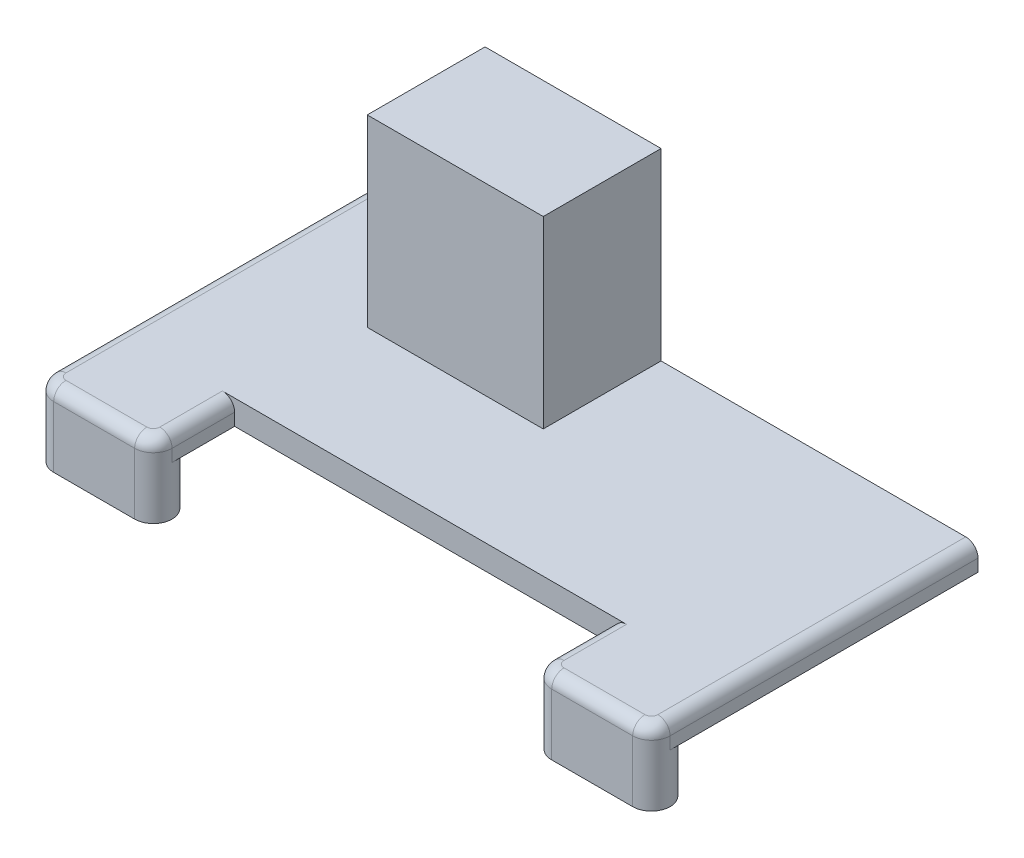
from build123d import *

# Parameters (mm, degrees)
BOSS_EXTRUDE1_DEPTH   = 4
BOSS_EXTRUDE1_2_DEPTH = 4
BOSS_EXTRUDE3_DEPTH   = 2
FILLET2_R             = 1
SKETCH4_W             = 14.347682942
SKETCH4_H             = 9.604544397
BOSS_EXTRUDE4_DEPTH   = 15


with BuildPart() as part:
    # Sketch1 → Boss-Extrude1 (new body)
    with BuildSketch(Plane(origin=(0, 0, 0), x_dir=(1, 0, 0), z_dir=(0, 1, 0))):
        with BuildLine():
            Line((-23.6, 10.542278437), (-17, 10.542278437))
            ThreePointArc((-17, 10.542278437), (-15.475, 9.017278437), (-17, 7.492278437))
            Line((-17, 7.492278437), (-23.6, 7.492278437))
            ThreePointArc((-23.6, 7.492278437), (-25.125, 9.017278437), (-23.6, 10.542278437))
        make_face()
    extrude(amount=BOSS_EXTRUDE1_DEPTH)



with BuildPart() as body_2:
    # Sketch1 → Boss-Extrude1 2 (new body)
    with BuildSketch(Plane(origin=(0, 0, 0), x_dir=(1, 0, 0), z_dir=(0, 1, 0))):
        with BuildLine():
            Line((23.6, 7.492278437), (17, 7.492278437))
            ThreePointArc((17, 7.492278437), (15.475, 9.017278437), (17, 10.542278437))
            Line((17, 10.542278437), (23.6, 10.542278437))
            ThreePointArc((23.6, 10.542278437), (25.125, 9.017278437), (23.6, 7.492278437))
        make_face()
    extrude(amount=BOSS_EXTRUDE1_2_DEPTH)


with BuildPart() as part_1:
    add(part.part)

    add(body_2.part)  # Boss-Extrude3 merges body 2
    # Sketch3 → Boss-Extrude3 (add)
    with BuildSketch(Plane(origin=(0, 4, 0), x_dir=(1, 0, 0), z_dir=(0, 1, 0))):
        with BuildLine():
            ThreePointArc((15.475, 9.017278437), (15.921662159, 7.938940596), (17, 7.492278437))
            Line((17, 7.492278437), (23.6, 7.492278437))
            ThreePointArc((23.6, 7.492278437), (24.678337841, 7.938940596), (25.125, 9.017278437))
            Line((25.125, 9.017278437), (25.125, 17.305889592))
            Line((25.125, 17.305889592), (25.125, 34.117278437))
            Line((25.125, 34.117278437), (-25.125, 34.117278437))
            Line((-25.125, 34.117278437), (-25.125, 17.305889592))
            Line((-25.125, 17.305889592), (-25.125, 9.017278437))
            ThreePointArc((-25.125, 9.017278437), (-24.678337841, 10.095616278), (-23.6, 10.542278437))
            Line((-23.6, 10.542278437), (-17, 10.542278437))
            ThreePointArc((-17, 10.542278437), (-15.921662159, 10.095616278), (-15.475, 9.017278437))
            Line((-15.475, 9.017278437), (-15.475, 14.117278437))
            Line((-15.475, 14.117278437), (15.475, 14.117278437))
            Line((15.475, 14.117278437), (15.475, 9.017278437))
        make_face()
        with BuildLine():
            Line((-17, 10.542278437), (-23.6, 10.542278437))
            ThreePointArc((-23.6, 10.542278437), (-25.125, 9.017278437), (-23.6, 7.492278437))
            Line((-23.6, 7.492278437), (-17, 7.492278437))
            ThreePointArc((-17, 7.492278437), (-15.475, 9.017278437), (-17, 10.542278437))
        make_face()
    extrude(amount=BOSS_EXTRUDE3_DEPTH)

    # Fillet2
    fillet2_edges = [part_1.edges().sort_by_distance(p)[0] for p in [
        (-25.125, 6, -21.567278437),
        (15.475, 6, -11.567278437),
        (-24.678337841, 6, -7.938940596),
        (-20.3, 6, -7.492278437),
        (-15.921662159, 6, -7.938940596),
        (-15.475, 6, -11.567278437),
        (15.921662159, 6, -7.938940596),
        (20.3, 6, -7.492278437),
        (24.678337841, 6, -7.938940596),
        (25.125, 6, -21.567278437),
    ]]
    fillet(fillet2_edges, radius=FILLET2_R)

    # Sketch4 → Boss-Extrude4 (add)
    with BuildSketch(Plane(origin=(0, 6, 0), x_dir=(1, 0, 0), z_dir=(0, 1, 0))):
        with Locations((-7.885296824, 29.315006239)):
            Rectangle(SKETCH4_W, SKETCH4_H)
    extrude(amount=BOSS_EXTRUDE4_DEPTH)


solid = part_1.part
